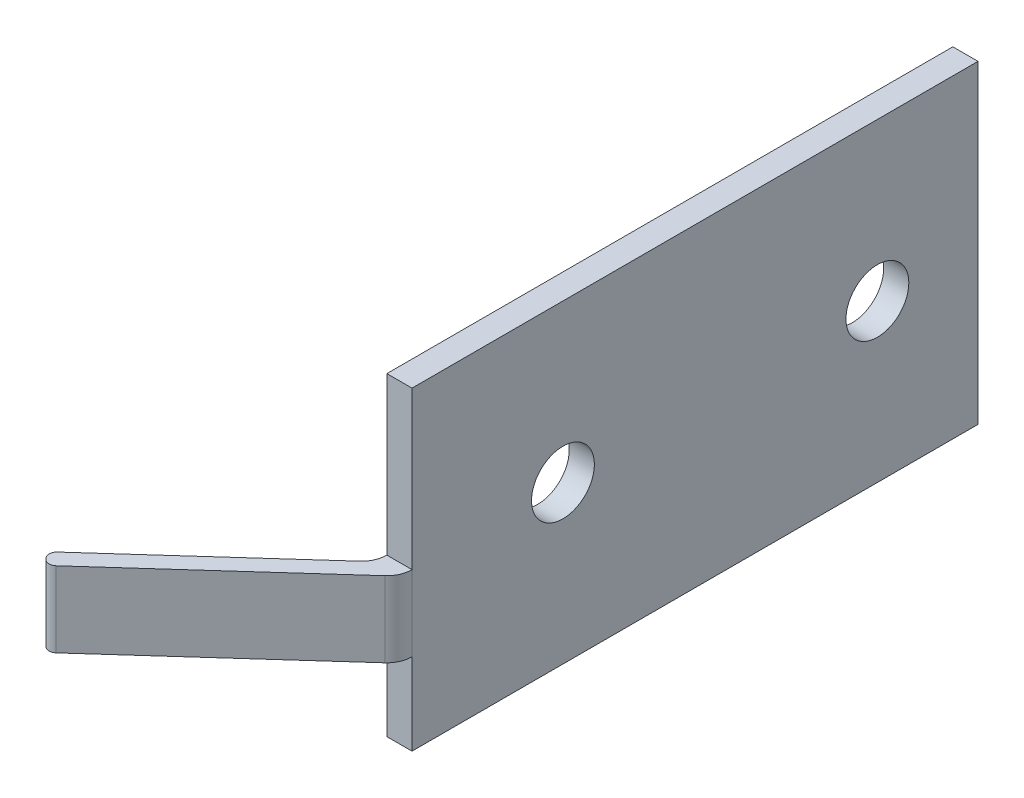
from build123d import *

# Parameters (mm, degrees)
SKETCH1_W           = 2
SKETCH1_H           = 45
BOSS_EXTRUDE1_DEPTH = 12.5
BOSS_EXTRUDE2_START = -12.5
BOSS_EXTRUDE2_DEPTH = 6
SKETCH3_R           = 2.5
CUT_EXTRUDE1_DEPTH  = 3


with BuildPart() as part:
    # Sketch1 → Boss-Extrude1 (new, symmetric)
    with BuildSketch(Plane(origin=(0, 0, 0), x_dir=(1, 0, 0), z_dir=(0, 1, 0))):
        Rectangle(SKETCH1_W, SKETCH1_H)
    extrude(amount=BOSS_EXTRUDE1_DEPTH, both=True)

    # Sketch2 → Boss-Extrude2 (add)
    with BuildSketch(Plane(origin=(0, 12.5, 0), x_dir=(1, 0, 0), z_dir=(0, 1, 0)).offset(BOSS_EXTRUDE2_START)):
        with BuildLine():
            Line((1, -22.5), (1, -22.509542629))
            ThreePointArc((1, -22.509542629), (0.827090915, -23.323015916), (0.338261213, -23.99583228))
            Line((0.338261213, -23.99583228), (-13.417009614, -36.381133763))
            ThreePointArc((-13.417009614, -36.381133763), (-13.849889552, -36.534424589), (-14.264374873, -36.336725232))
            Line((-14.264374873, -36.336725232), (-14.356889682, -36.233977127))
            ThreePointArc((-14.356889682, -36.233977127), (-14.510180508, -35.80109719), (-14.312481151, -35.386611868))
            Line((-14.312481151, -35.386611868), (-1.661738787, -23.99583228))
            ThreePointArc((-1.661738787, -23.99583228), (-1.172909085, -23.323015916), (-1, -22.509542629))
            Line((-1, -22.509542629), (-1, -22.5))
            Line((-1, -22.5), (1, -22.5))
        make_face()
    extrude(amount=-BOSS_EXTRUDE2_DEPTH)

    # Sketch3 → Cut-Extrude1 (cut, symmetric)
    with BuildSketch(Plane(origin=(1, 0, 0), x_dir=(0, 0, -1), z_dir=(1, 0, 0))):
        with Locations((-10.5, 0)):
            Circle(SKETCH3_R)
        with Locations((14.5, 0)):
            Circle(SKETCH3_R)
    extrude(amount=CUT_EXTRUDE1_DEPTH, both=True, mode=Mode.SUBTRACT)


solid = part.part
